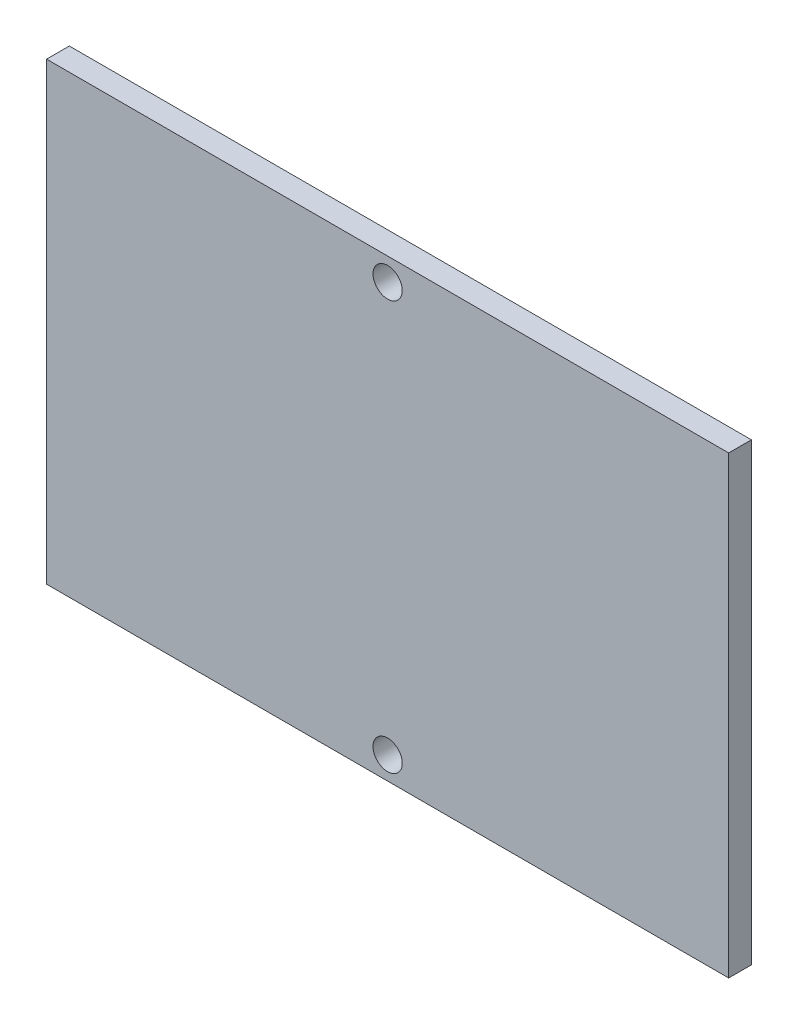
from build123d import *

# Parameters (mm, degrees)
SKETCH2_W           = 76.2
SKETCH2_H           = 50.8
BOSS_EXTRUDE1_DEPTH = 2.54
SKETCH6_R           = 1.630985467
CUT_EXTRUDE1_DEPTH  = 75.260100403
SKETCH7_R           = 1.630985467
CUT_EXTRUDE2_DEPTH  = 75.260100403


with BuildPart() as part:
    # Sketch2 → Boss-Extrude1 (new body)
    with BuildSketch(Plane.XY):
        with Locations((-22.957692308, 16.790865385)):
            Rectangle(SKETCH2_W, SKETCH2_H)
    extrude(amount=BOSS_EXTRUDE1_DEPTH)

    # Sketch6 → Cut-Extrude1 (cut, through all)
    with BuildSketch(Plane.XY.offset(2.54)):
        with Locations((-22.957692308, 39.650865385)):
            Circle(SKETCH6_R)
    extrude(amount=-CUT_EXTRUDE1_DEPTH, mode=Mode.SUBTRACT)

    # Sketch7 → Cut-Extrude2 (cut, through all)
    with BuildSketch(Plane.XY.offset(2.54)):
        with Locations((-22.957692308, -6.069134615)):
            Circle(SKETCH7_R)
    extrude(amount=-CUT_EXTRUDE2_DEPTH, mode=Mode.SUBTRACT)


solid = part.part
